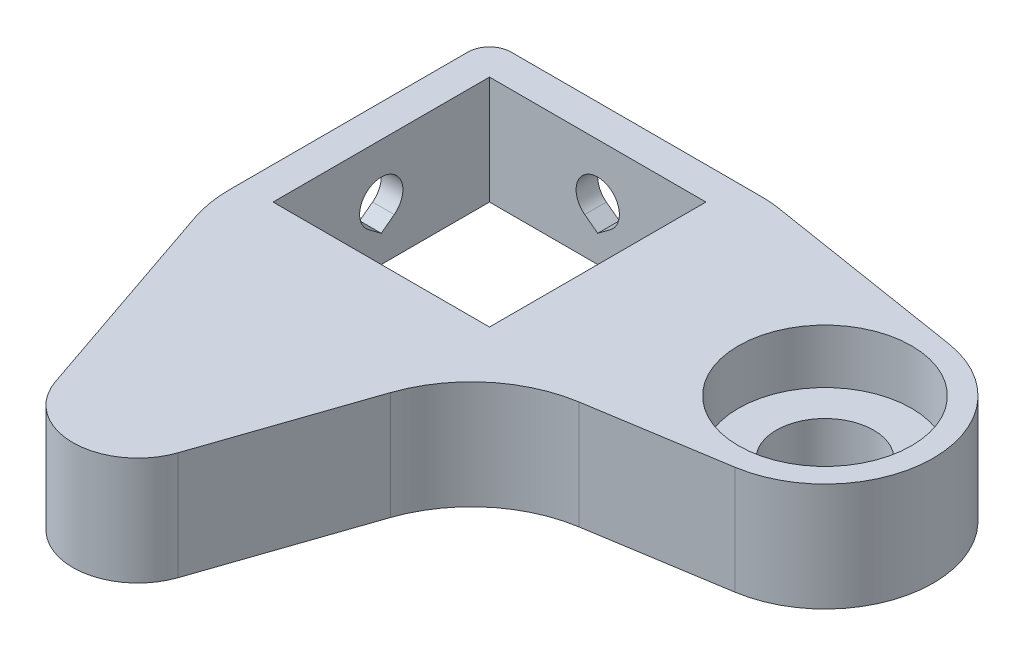
from build123d import *

# Parameters (mm, degrees)
SKETCH1_W                               = 20
SKETCH1_H                               = 20
BOSS_EXTRUDE1_DEPTH                     = 10
SKETCH2_R                               = 8
CUT_EXTRUDE2_DEPTH                      = 46
SKETCH3_R                               = 4
SKETCH3_R_2                             = 4.5
CUT_EXTRUDE3_DEPTH                      = 10
CBORE_FOR_M5_HEX_HEAD_BOLT1_D           = 4
CBORE_FOR_M5_HEX_HEAD_BOLT1_DEPTH       = 10
CBORE_FOR_M5_HEX_HEAD_BOLT1_CBORE_D     = 7
CBORE_FOR_M5_HEX_HEAD_BOLT1_CBORE_DEPTH = 1
CBORE_FOR_M5_HEX_HEAD_BOLT2_D           = 4
CBORE_FOR_M5_HEX_HEAD_BOLT2_DEPTH       = 10
CBORE_FOR_M5_HEX_HEAD_BOLT2_CBORE_D     = 7
CBORE_FOR_M5_HEX_HEAD_BOLT2_CBORE_DEPTH = 1
CUT_EXTRUDE4_DEPTH                      = 2
CUT_EXTRUDE5_DEPTH                      = 1
CUT_EXTRUDE6_DEPTH                      = 2
CUT_EXTRUDE7_DEPTH                      = 1


with BuildPart() as part:
    # Sketch1 → Boss-Extrude1 (new body)
    with BuildSketch(Plane(origin=(0, 0, 0), x_dir=(1, 0, 0), z_dir=(0, 1, 0))):
        with BuildLine():
            Line((23.939871077, 2.849965846), (42.576368333, -0.125028462))
            ThreePointArc((42.576368333, -0.125028462), (51, -10), (42.576368333, -19.874971538))
            Line((42.576368333, -19.874971538), (30.130588759, -21.86172489))
            ThreePointArc((30.130588759, -21.86172489), (24.291669579, -24.533541475), (20.666245259, -29.833341429))
            Line((20.666245259, -29.833341429), (15.677992749, -44.439174654))
            ThreePointArc((15.677992749, -44.439174654), (10, -48.5), (4.322007251, -44.439174654))
            Line((4.322007251, -44.439174654), (-2.355985499, -24.885704137))
            ThreePointArc((-2.355985499, -24.885704137), (-2.837901545, -22.973082941), (-3, -21.00735483))
            Line((-3, -21.00735483), (-3, 1))
            ThreePointArc((-3, 1), (-2.414213562, 2.414213562), (-1, 3))
            Line((-1, 3), (22.048229077, 3))
            ThreePointArc((22.048229077, 3), (22.997020375, 2.962432657), (23.939871077, 2.849965846))
        make_face()
        with Locations((10, -10)):
            Rectangle(SKETCH1_W, SKETCH1_H, mode=Mode.SUBTRACT)
    extrude(amount=BOSS_EXTRUDE1_DEPTH)

    # Sketch2 → Cut-Extrude2 (cut)
    with BuildSketch(Plane(origin=(0, 5, 0), x_dir=(1, 0, 0), z_dir=(0, 1, 0))):
        with Locations(Location((41, -10, 0), (0, 0, 90))):
            Circle(SKETCH2_R)
    extrude(amount=CUT_EXTRUDE2_DEPTH, mode=Mode.SUBTRACT)

    # Sketch3 → Cut-Extrude3 (cut)
    with BuildSketch(Plane(origin=(0, 5, 0), x_dir=(1, 0, 0), z_dir=(0, 1, 0))):
        with Locations(Location((10, -42.5, 0), (0, 0, 90))):
            Circle(SKETCH3_R)
        with Locations(Location((41, -10, 0), (0, 0, 90))):
            Circle(SKETCH3_R_2)
    extrude(amount=-CUT_EXTRUDE3_DEPTH, mode=Mode.SUBTRACT)

    # CBORE for M5 Hex Head Bolt1
    with Locations(Plane.ZY.offset(3)):
        with Locations((10, 5)):
            CounterBoreHole(CBORE_FOR_M5_HEX_HEAD_BOLT1_D / 2, CBORE_FOR_M5_HEX_HEAD_BOLT1_CBORE_D / 2, CBORE_FOR_M5_HEX_HEAD_BOLT1_CBORE_DEPTH, depth=CBORE_FOR_M5_HEX_HEAD_BOLT1_DEPTH)

    # CBORE for M5 Hex Head Bolt2
    with Locations(Plane(origin=(0, 0, -3), x_dir=(-1, 0, 0), z_dir=(0, 0, -1))):
        with Locations((-10, 5)):
            CounterBoreHole(CBORE_FOR_M5_HEX_HEAD_BOLT2_D / 2, CBORE_FOR_M5_HEX_HEAD_BOLT2_CBORE_D / 2, CBORE_FOR_M5_HEX_HEAD_BOLT2_CBORE_DEPTH, depth=CBORE_FOR_M5_HEX_HEAD_BOLT2_DEPTH)

    # Sketch9 → Cut-Extrude4 (cut)
    with BuildSketch(Plane(origin=(0, 0, -2), x_dir=(-1, 0, 0), z_dir=(0, 0, -1))):
        Polygon((-10, 2.5), (-8.8, 3.4), (-11.2, 3.4), align=None)
    extrude(amount=-CUT_EXTRUDE4_DEPTH, mode=Mode.SUBTRACT)

    # Sketch10 → Cut-Extrude5 (cut)
    with BuildSketch(Plane(origin=(0, 0, -2), x_dir=(-1, 0, 0), z_dir=(0, 0, -1))):
        Polygon((-10, 0.5), (-7.800112236, 2.277777778), (-12.199887764, 2.277777778), align=None)
    extrude(amount=CUT_EXTRUDE5_DEPTH, mode=Mode.SUBTRACT)

    # Sketch11 → Cut-Extrude6 (cut)
    with BuildSketch(Plane.ZY.offset(2)):
        Polygon((10, 2.5), (11.2, 3.4), (8.8, 3.4), align=None)
    extrude(amount=-CUT_EXTRUDE6_DEPTH, mode=Mode.SUBTRACT)

    # Sketch13 → Cut-Extrude7 (cut)
    with BuildSketch(Plane.ZY.offset(2)):
        Polygon((10, 0.5), (7.800112236, 2.277777778), (12.199887764, 2.277777778), align=None)
    extrude(amount=CUT_EXTRUDE7_DEPTH, mode=Mode.SUBTRACT)


solid = part.part
